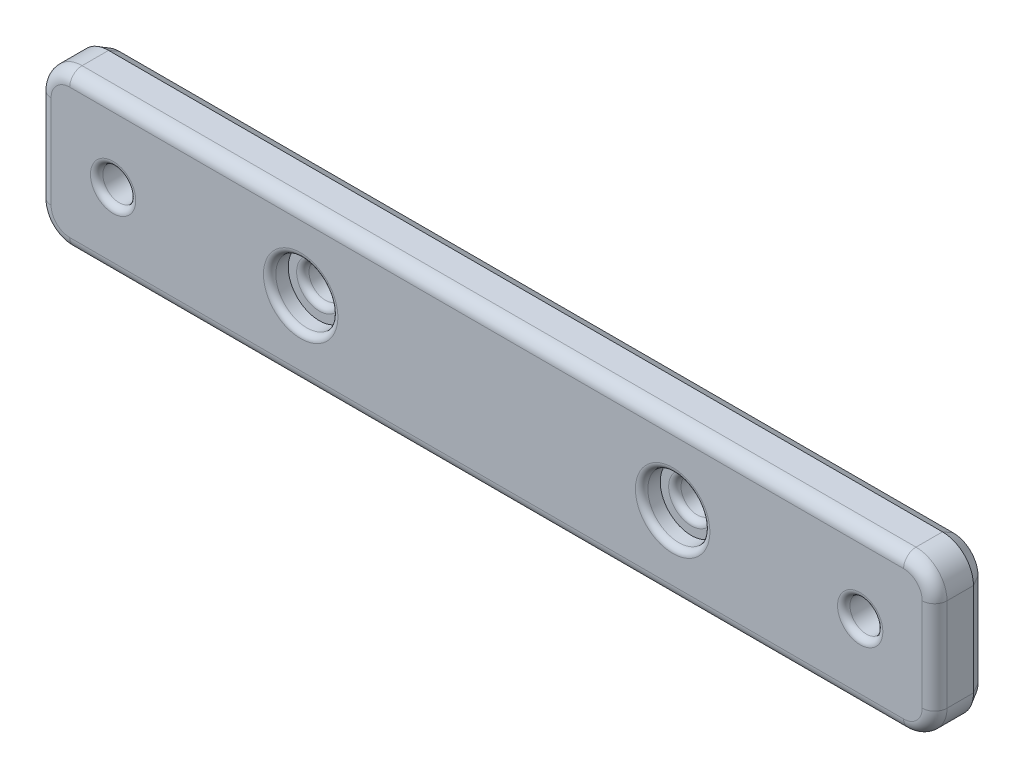
from build123d import *
from OCP.BRepFilletAPI import BRepFilletAPI_MakeChamfer

# Parameters (mm, degrees)
SKETCH2_W           = 144.5
SKETCH2_H           = 25
BOSS_EXTRUDE1_DEPTH = 8
SKETCH3_R           = 2.65
CUT_EXTRUDE1_DEPTH  = 74.758474089
SKETCH4_R           = 5
CUT_EXTRUDE2_DEPTH  = 3
FILLET1_R           = 5
FILLET2_R           = 2
FILLET3_R           = 1
CHAMFER1_SIZE       = 1
CHAMFER1_SIZE2      = 1.732050808
CHAMFER2_SIZE       = 1
CHAMFER2_SIZE2      = 0.577350269


with BuildPart() as part:
    # Sketch2 → Boss-Extrude1 (new body)
    with BuildSketch(Plane.XY):
        Rectangle(SKETCH2_W, SKETCH2_H)
    extrude(amount=BOSS_EXTRUDE1_DEPTH)

    # Sketch3 → Cut-Extrude1 (cut, through all)
    with BuildSketch(Plane.XY.offset(8)):
        with Locations((-60.25, 0)):
            Circle(SKETCH3_R)
        with Locations((60.25, 0)):
            Circle(SKETCH3_R)
        with Locations((-30, 0)):
            Circle(SKETCH3_R)
        with Locations((30, 0)):
            Circle(SKETCH3_R)
    extrude(amount=-CUT_EXTRUDE1_DEPTH, mode=Mode.SUBTRACT)

    # Sketch4 → Cut-Extrude2 (cut)
    with BuildSketch(Plane.XY.offset(8)):
        with Locations((-30, 0)):
            Circle(SKETCH4_R)
        with Locations((30, 0)):
            Circle(SKETCH4_R)
    extrude(amount=-CUT_EXTRUDE2_DEPTH, mode=Mode.SUBTRACT)

    # Fillet1
    fillet1_edges = [part.edges().sort_by_distance(p)[0] for p in [
        (72.25, -12.5, 4),
        (-72.25, -12.5, 4),
        (-72.25, 12.5, 4),
        (72.25, 12.5, 4),
    ]]
    fillet(fillet1_edges, radius=FILLET1_R)

    # Fillet2
    fillet2_edges = [part.edges().sort_by_distance(p)[0] for p in [
        (0, -12.5, 8),
        (-72.25, 0, 8),
        (72.25, 0, 8),
        (0, 12.5, 8),
        (70.785533906, 11.035533906, 8),
        (70.785533906, -11.035533906, 8),
        (-70.785533906, 11.035533906, 8),
        (-70.785533906, -11.035533906, 8),
    ]]
    fillet(fillet2_edges, radius=FILLET2_R)

    # Fillet3
    fillet3_edges = [part.edges().sort_by_distance(p)[0] for p in [
        (-62.9, 0, 8),
        (57.6, 0, 8),
        (-35, 0, 8),
        (-32.65, 0, 5),
        (25, 0, 8),
        (27.35, 0, 5),
    ]]
    fillet(fillet3_edges, radius=FILLET3_R)

    # Chamfer1
    chamfer1_edges = [part.edges().sort_by_distance(p)[0] for p in [
        (0, -12.5, 0),
        (72.25, 0, 0),
        (-72.25, 0, 0),
        (0, 12.5, 0),
        (70.785533906, 11.035533906, 0),
        (70.785533906, -11.035533906, 0),
        (-70.785533906, 11.035533906, 0),
        (-70.785533906, -11.035533906, 0),
    ]]
    chamfer1_side = [part.faces().sort_by_distance(p)[0] for p in [
        (0, 0, 0),
    ]]
    chamfer(chamfer1_edges, length=CHAMFER1_SIZE, length2=CHAMFER1_SIZE2, reference=chamfer1_side[0])

    # Chamfer2: one chamfer whose edges measure the first distance from different faces: ONE call of the kernel's chamfer builder (chamfer() names one face for all edges)
    chamfer2_edges_1 = [part.edges().sort_by_distance(p)[0] for p in [
        (-62.9, 0, 0),
    ]]
    chamfer2_side_1 = [part.faces().sort_by_distance(p)[0] for p in [
        (-62.9, 0, 3.5),
    ]]
    chamfer2_edges_2 = [part.edges().sort_by_distance(p)[0] for p in [
        (27.35, 0, 0),
    ]]
    chamfer2_side_2 = [part.faces().sort_by_distance(p)[0] for p in [
        (27.35, 0, 2),
    ]]
    chamfer2_edges_3 = [part.edges().sort_by_distance(p)[0] for p in [
        (-32.65, 0, 0),
    ]]
    chamfer2_side_3 = [part.faces().sort_by_distance(p)[0] for p in [
        (-32.65, 0, 2),
    ]]
    chamfer2_edges_4 = [part.edges().sort_by_distance(p)[0] for p in [
        (57.6, 0, 0),
    ]]
    chamfer2_side_4 = [part.faces().sort_by_distance(p)[0] for p in [
        (57.6, 0, 3.5),
    ]]
    chamfer2 = BRepFilletAPI_MakeChamfer(part.part.solid().wrapped)
    for e in chamfer2_edges_1:
        chamfer2.Add(CHAMFER2_SIZE, CHAMFER2_SIZE2, e.wrapped, chamfer2_side_1[0].wrapped)  # the first distance lies on this face
    for e in chamfer2_edges_2:
        chamfer2.Add(CHAMFER2_SIZE, CHAMFER2_SIZE2, e.wrapped, chamfer2_side_2[0].wrapped)  # the first distance lies on this face
    for e in chamfer2_edges_3:
        chamfer2.Add(CHAMFER2_SIZE, CHAMFER2_SIZE2, e.wrapped, chamfer2_side_3[0].wrapped)  # the first distance lies on this face
    for e in chamfer2_edges_4:
        chamfer2.Add(CHAMFER2_SIZE, CHAMFER2_SIZE2, e.wrapped, chamfer2_side_4[0].wrapped)  # the first distance lies on this face
    add(Compound.cast(chamfer2.Shape()), mode=Mode.REPLACE)


solid = part.part
